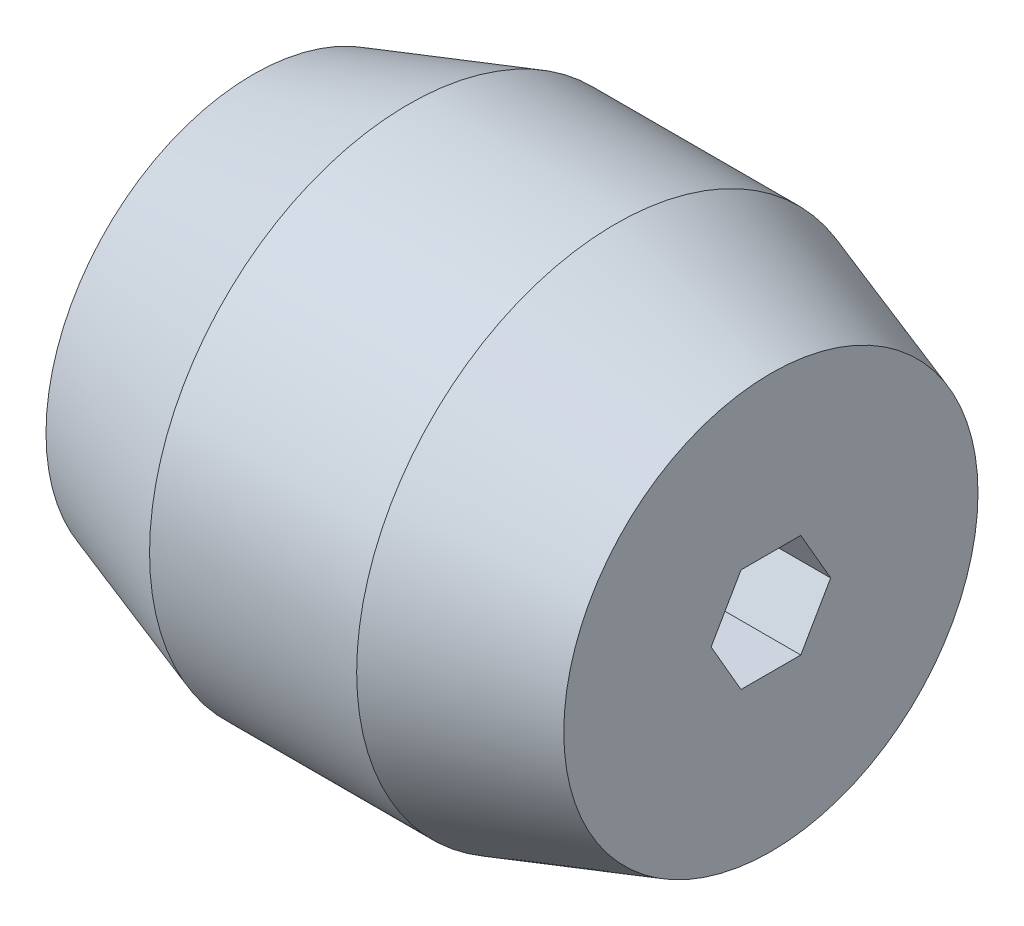
from build123d import *

# Parameters (mm, degrees)
CUT_EXTRUDE1_DEPTH      = 78.771299333
CUT_EXTRUDE1_DEPTH_BACK = 78.771299333


with BuildPart() as part:
    # Sketch1 → Revolve1 (revolve)
    with BuildSketch(Plane.XY, mode=Mode.PRIVATE) as revolve1_sk:
        Polygon((0, 0), (63.5, 0), (63.5, 25.4), (44.45, 31.75), (19.05, 31.75), (0, 25.4), align=None)
    revolve(revolve1_sk.sketch.rotate(Axis((0, 0, 0), (1, 0, 0)), 90), axis=Axis((0, 0, 0), (1, 0, 0)))

    # Sketch2 → Cut-Extrude1 (cut, two sides: drawn at the far end of the back side and taken through both)
    with BuildSketch(Plane.ZY.offset(-CUT_EXTRUDE1_DEPTH_BACK)):
        Polygon((-3.666174209, 6.35), (-7.332348419, 0), (-3.666174209, -6.35), (3.666174209, -6.35), (7.332348419, 0), (3.666174209, 6.35), align=None)
    extrude(amount=CUT_EXTRUDE1_DEPTH + CUT_EXTRUDE1_DEPTH_BACK, mode=Mode.SUBTRACT)


solid = part.part
